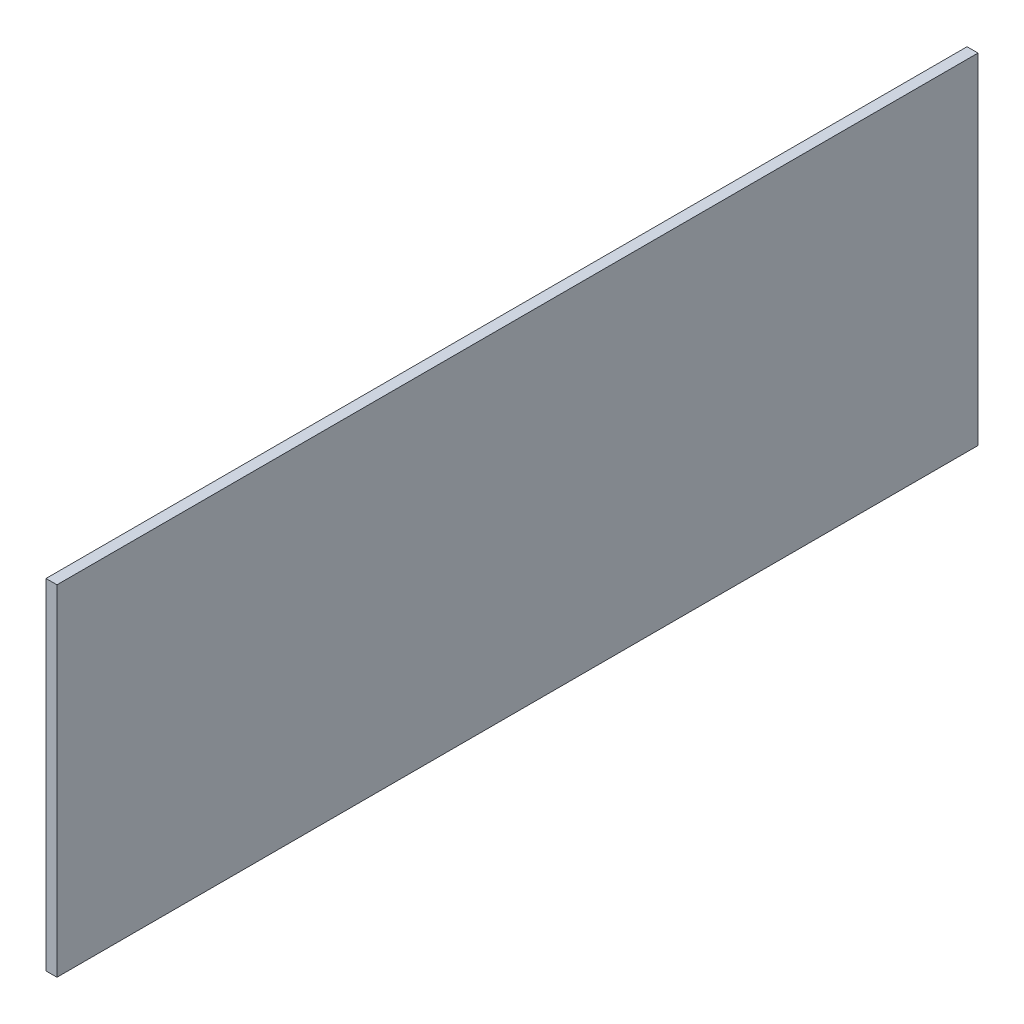
from build123d import *

# Parameters (mm, degrees)
SKETCH1_W           = 2100
SKETCH1_H           = 775
BOSS_EXTRUDE1_DEPTH = 25


with BuildPart() as part:
    # Sketch1 → Boss-Extrude1 (new body)
    with BuildSketch(Plane(origin=(0, 0, 0), x_dir=(0, 0, -1), z_dir=(1, 0, 0))):
        with Locations((1050, 387.5)):
            Rectangle(SKETCH1_W, SKETCH1_H)
    extrude(amount=BOSS_EXTRUDE1_DEPTH)


solid = part.part
